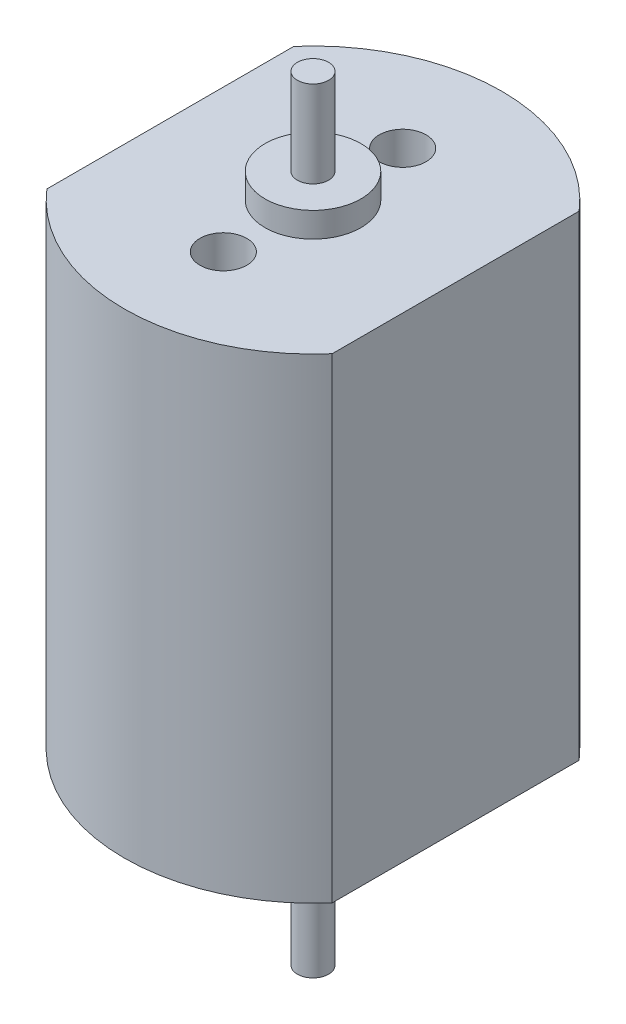
from build123d import *

# Parameters (mm, degrees)
BOSS_EXTRUDE1_DEPTH = 30.5
SKETCH2_R           = 3.075
SKETCH2_R_2         = 1
BOSS_EXTRUDE2_DEPTH = 1.6
SKETCH2_2_R         = 1
BOSS_EXTRUDE3_DEPTH = 7.15
BOSS_EXTRUDE4_START = 2
SKETCH3_R           = 4
SKETCH3_R_2         = 1
BOSS_EXTRUDE4_DEPTH = 2
BOSS_EXTRUDE5_START = 12
SKETCH3_2_R         = 1
BOSS_EXTRUDE5_DEPTH = 12
SKETCH4_R           = 1.5
CUT_EXTRUDE1_DEPTH  = 5


with BuildPart() as part:
    # Sketch1 → Boss-Extrude1 (new body)
    with BuildSketch(Plane(origin=(0, 0, 0), x_dir=(1, 0, 0), z_dir=(0, 1, 0))):
        with BuildLine():
            Line((-9.15, 7.917543811), (-9.15, -7.917543811))
            ThreePointArc((-9.15, -7.917543811), (0, -12.1), (9.15, -7.917543811))
            Line((9.15, -7.917543811), (9.15, 7.917543811))
            ThreePointArc((9.15, 7.917543811), (0, 12.1), (-9.15, 7.917543811))
        make_face()
    extrude(amount=BOSS_EXTRUDE1_DEPTH)

    # Sketch2 → Boss-Extrude2 (add)
    with BuildSketch(Plane(origin=(0, 30.5, 0), x_dir=(1, 0, 0), z_dir=(0, 1, 0))):
        Circle(SKETCH2_R)
        Circle(SKETCH2_R_2, mode=Mode.SUBTRACT)
    extrude(amount=BOSS_EXTRUDE2_DEPTH)

    # Sketch2<2> → Boss-Extrude3 (add)
    with BuildSketch(Plane(origin=(0, 30.5, 0), x_dir=(1, 0, 0), z_dir=(0, 1, 0))):
        Circle(SKETCH2_2_R)
    extrude(amount=BOSS_EXTRUDE3_DEPTH)

    # Sketch3 → Boss-Extrude4 (add)
    with BuildSketch(Plane.XZ.offset(BOSS_EXTRUDE4_START)):
        Circle(SKETCH3_R)
        Circle(SKETCH3_R_2, mode=Mode.SUBTRACT)
    extrude(amount=-BOSS_EXTRUDE4_DEPTH)

    # Sketch3<2> → Boss-Extrude5 (add)
    with BuildSketch(Plane.XZ.offset(BOSS_EXTRUDE5_START)):
        Circle(SKETCH3_2_R)
    extrude(amount=-BOSS_EXTRUDE5_DEPTH)

    # Sketch4 → Cut-Extrude1 (cut)
    with BuildSketch(Plane(origin=(0, 30.5, 0), x_dir=(1, 0, 0), z_dir=(0, 1, 0))):
        with Locations((0, 5.75)):
            Circle(SKETCH4_R)
        with Locations((0, -5.75)):
            Circle(SKETCH4_R)
    extrude(amount=-CUT_EXTRUDE1_DEPTH, mode=Mode.SUBTRACT)


solid = part.part
